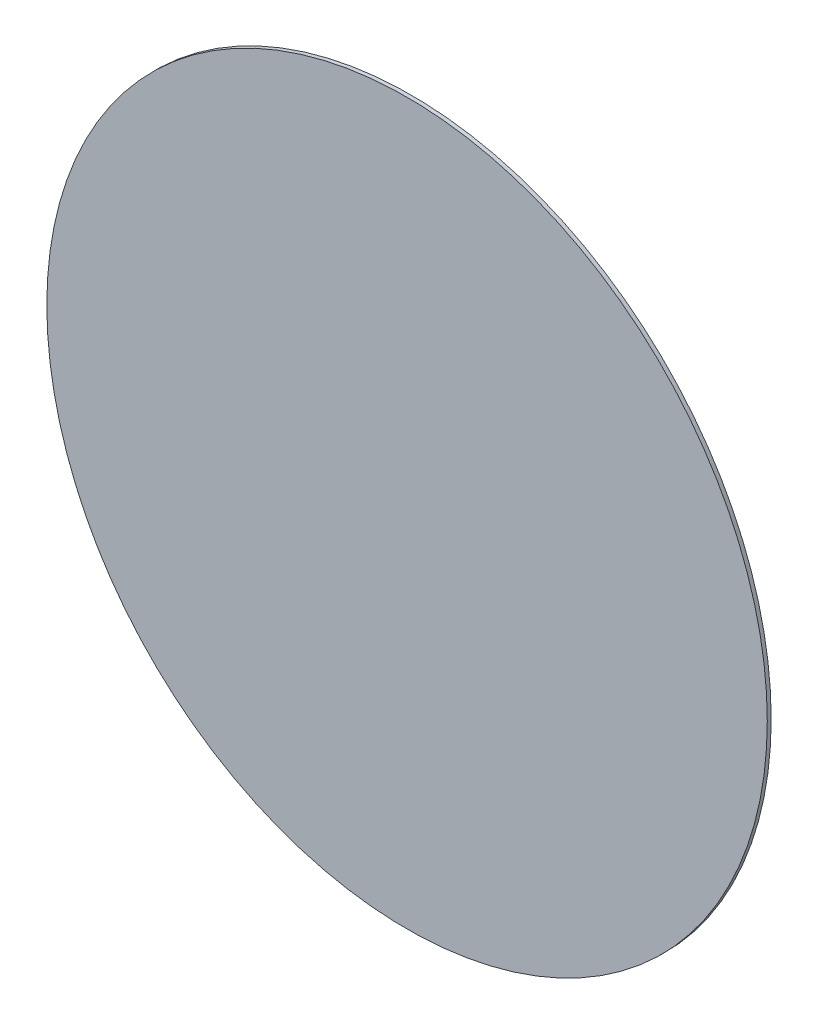
from build123d import *

# Parameters (mm, degrees)
SKETCH_1_R      = 18.5
EXTRUDE_1_DEPTH = 0.2


with BuildPart() as part:
    # Эскиз1 → Бобышка-Вытянуть1 (new body)
    with BuildSketch(Plane.XY):
        Circle(SKETCH_1_R)
    extrude(amount=EXTRUDE_1_DEPTH)


solid = part.part
